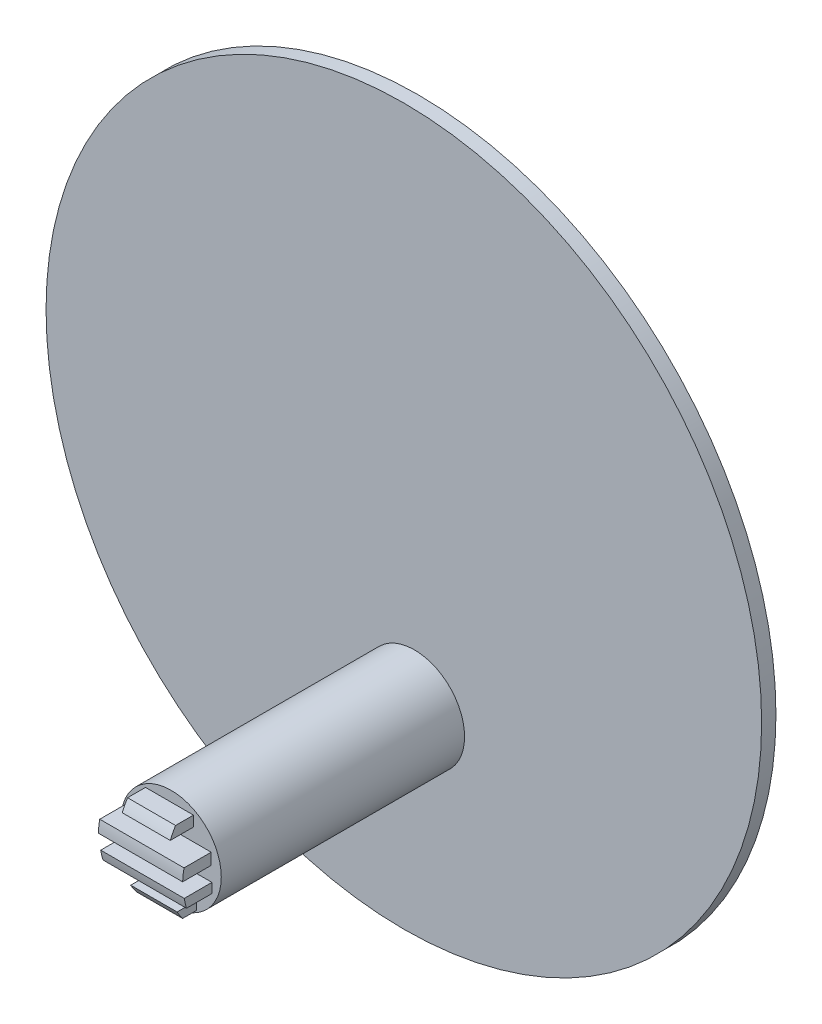
from build123d import *

# Parameters (mm, degrees)
SKETCH1_R                = 10
BOSS_EXTRUDE1_DEPTH      = 0.4
SKETCH2_R                = 1.4
BOSS_EXTRUDE2_DEPTH      = 6.8
BOSS_EXTRUDE4_REACH      = 22.341
BOSS_EXTRUDE4_END_RADIUS = 2
SKETCH5_W                = 1.296800958
SKETCH5_H                = 0.234337446
BOSS_EXTRUDE5_REACH      = 22.341
BOSS_EXTRUDE5_END_RADIUS = 2
SKETCH6_W                = 2.334473836
SKETCH6_H                = 0.270371377
BOSS_EXTRUDE6_REACH      = 22.341
BOSS_EXTRUDE6_END_RADIUS = 2
SKETCH7_W                = 2.355867359
SKETCH7_H                = 0.318641547
BOSS_EXTRUDE7_REACH      = 22.341
BOSS_EXTRUDE7_END_RADIUS = 2
SKETCH8_W                = 1.341324005
SKETCH8_H                = 0.289222795


with BuildPart() as part:
    # Sketch1 → Boss-Extrude1 (new body)
    with BuildSketch(Plane.XY):
        with Locations((-6.184372355, 0)):
            Circle(SKETCH1_R)
    extrude(amount=BOSS_EXTRUDE1_DEPTH)

    # Sketch2 → Boss-Extrude2 (add)
    with BuildSketch(Plane.XY.offset(0.4)):
        with Locations((-5.886934799, -4.488089726)):
            Circle(SKETCH2_R)
    extrude(amount=BOSS_EXTRUDE2_DEPTH)

    # Boss-Extrude5: up to this cylinder (the profile starts inside it)
    boss_extrude5_end = Plane(origin=(-5.914638, -4.427094914, 6), z_dir=(1, 0, 0)) * Cylinder(BOSS_EXTRUDE5_END_RADIUS, 49.682, mode=Mode.PRIVATE)
    # Sketch6 → Boss-Extrude5 (add, up to the surface)
    with BuildSketch(Plane.XY.offset(7.2), mode=Mode.PRIVATE) as boss_extrude5_sk1:
        with Locations((-5.914638283, -4.88134499)):
            Rectangle(SKETCH6_W, SKETCH6_H)
    boss_extrude5_tool1 = extrude(boss_extrude5_sk1.sketch, amount=BOSS_EXTRUDE5_REACH, mode=Mode.PRIVATE) & boss_extrude5_end
    add(boss_extrude5_tool1.solids().sort_by_distance((-5.914638, -4.881345, 7.2))[0])

    # Boss-Extrude6: up to this cylinder (the profile starts inside it)
    boss_extrude6_end = Plane(origin=(-5.946542, -4.427094914, 6), z_dir=(1, 0, 0)) * Cylinder(BOSS_EXTRUDE6_END_RADIUS, 49.682, mode=Mode.PRIVATE)
    # Sketch7 → Boss-Extrude6 (add, up to the surface)
    with BuildSketch(Plane.XY.offset(7.2), mode=Mode.PRIVATE) as boss_extrude6_sk1:
        with Locations((-5.946542218, -4.185509646)):
            Rectangle(SKETCH7_W, SKETCH7_H)
    boss_extrude6_tool1 = extrude(boss_extrude6_sk1.sketch, amount=BOSS_EXTRUDE6_REACH, mode=Mode.PRIVATE) & boss_extrude6_end
    add(boss_extrude6_tool1.solids().sort_by_distance((-5.946542, -4.18551, 7.2))[0])

    # Boss-Extrude7: up to this cylinder (the profile starts inside it)
    boss_extrude7_end = Plane(origin=(-5.934292, -4.427094914, 6), z_dir=(1, 0, 0)) * Cylinder(BOSS_EXTRUDE7_END_RADIUS, 49.682, mode=Mode.PRIVATE)
    # Sketch8 → Boss-Extrude7 (add, up to the surface)
    with BuildSketch(Plane.XY.offset(7.2), mode=Mode.PRIVATE) as boss_extrude7_sk1:
        with Locations((-5.934291899, -3.520470411)):
            Rectangle(SKETCH8_W, SKETCH8_H)
    boss_extrude7_tool1 = extrude(boss_extrude7_sk1.sketch, amount=BOSS_EXTRUDE7_REACH, mode=Mode.PRIVATE) & boss_extrude7_end
    add(boss_extrude7_tool1.solids().sort_by_distance((-5.934292, -3.52047, 7.2))[0])


with BuildPart() as body_2:
    # Boss-Extrude4: up to this cylinder (the profile starts inside it)
    boss_extrude4_end = Plane(origin=(-5.825593, -4.427094914, 6), z_dir=(1, 0, 0)) * Cylinder(BOSS_EXTRUDE4_END_RADIUS, 49.682, mode=Mode.PRIVATE)
    # Sketch5 → Boss-Extrude4 (new, up to the surface)
    with BuildSketch(Plane.XY.offset(7.2), mode=Mode.PRIVATE) as boss_extrude4_sk1:
        with Locations((-5.825593386, -5.522131989)):
            Rectangle(SKETCH5_W, SKETCH5_H)
    boss_extrude4_tool1 = extrude(boss_extrude4_sk1.sketch, amount=BOSS_EXTRUDE4_REACH, mode=Mode.PRIVATE) & boss_extrude4_end
    add(boss_extrude4_tool1.solids().sort_by_distance((-5.825593, -5.522132, 7.2))[0])


solid = Compound([part.part, body_2.part])
